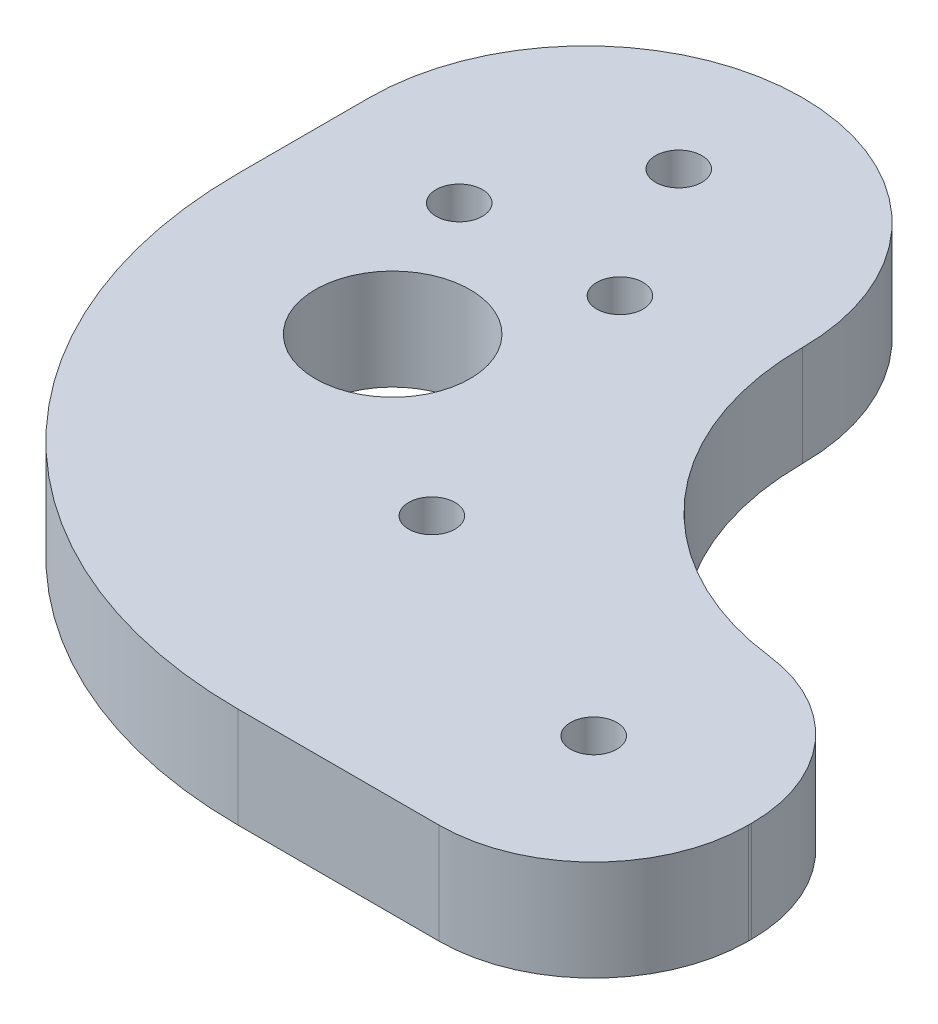
from build123d import *

# Parameters (mm, degrees)
SKETCH_1_R      = 1.5
SKETCH_1_R_2    = 5
EXTRUDE_1_DEPTH = 3.5
SKETCH_1_2_R    = 1.5
SKETCH_1_2_R_2  = 5
EXTRUDE_2_DEPTH = 6.5
FILLET_3_R      = 10
FILLET_4_R      = 10
FILLET_5_R      = 30


with BuildPart() as part:
    # 草图1 → 凸台-拉伸1 (new body)
    with BuildSketch(Plane(origin=(0, 0, 0), x_dir=(1, 0, 0), z_dir=(0, 1, 0))):
        with BuildLine():
            Line((0, 0), (53, 0))
            Line((53, 0), (53, 20))
            Line((53, 20), (46.5, 20))
            ThreePointArc((46.5, 20), (33.418524548, 25.418524548), (28, 38.5))
            ThreePointArc((28, 38.5), (14, 52.5), (0, 38.5))
            Line((0, 38.5), (0, 0))
        make_face()
        with Locations((14, 44.5)):
            Circle(SKETCH_1_R, mode=Mode.SUBTRACT)
        with Locations((19.196152423, 35.5)):
            Circle(SKETCH_1_R, mode=Mode.SUBTRACT)
        with Locations((43, 10)):
            Circle(SKETCH_1_R, mode=Mode.SUBTRACT)
        with Locations((14, 26)):
            Circle(SKETCH_1_R_2, mode=Mode.SUBTRACT)
        with Locations((8.803847577, 35.5)):
            Circle(SKETCH_1_R, mode=Mode.SUBTRACT)
        with Locations((25.441221962, 17.093145751)):
            Circle(SKETCH_1_R, mode=Mode.SUBTRACT)
    extrude(amount=EXTRUDE_1_DEPTH)

    # 草图1<2> → 凸台-拉伸2 (add)
    with BuildSketch(Plane(origin=(0, 0, 0), x_dir=(1, 0, 0), z_dir=(0, 1, 0))):
        with BuildLine():
            Line((0, 0), (53, 0))
            Line((53, 0), (53, 20))
            Line((53, 20), (46.5, 20))
            ThreePointArc((46.5, 20), (33.418524548, 25.418524548), (28, 38.5))
            ThreePointArc((28, 38.5), (14, 52.5), (0, 38.5))
            Line((0, 38.5), (0, 0))
        make_face()
        with Locations((14, 44.5)):
            Circle(SKETCH_1_2_R, mode=Mode.SUBTRACT)
        with Locations((19.196152423, 35.5)):
            Circle(SKETCH_1_2_R, mode=Mode.SUBTRACT)
        with Locations((43, 10)):
            Circle(SKETCH_1_2_R, mode=Mode.SUBTRACT)
        with Locations((14, 26)):
            Circle(SKETCH_1_2_R_2, mode=Mode.SUBTRACT)
        with Locations((8.803847577, 35.5)):
            Circle(SKETCH_1_2_R, mode=Mode.SUBTRACT)
        with Locations((25.441221962, 17.093145751)):
            Circle(SKETCH_1_2_R, mode=Mode.SUBTRACT)
    extrude(amount=EXTRUDE_2_DEPTH)

    # 圆角3
    fillet_3_edges = [part.edges().sort_by_distance(p)[0] for p in [
        (53, 3.25, 0),
    ]]
    fillet(fillet_3_edges, radius=FILLET_3_R)

    # 圆角4
    fillet_4_edges = [part.edges().sort_by_distance(p)[0] for p in [
        (53, 3.25, -20),
    ]]
    fillet(fillet_4_edges, radius=FILLET_4_R)

    # 圆角5
    fillet_5_edges = [part.edges().sort_by_distance(p)[0] for p in [
        (0, 3.25, 0),
    ]]
    fillet(fillet_5_edges, radius=FILLET_5_R)


solid = part.part
